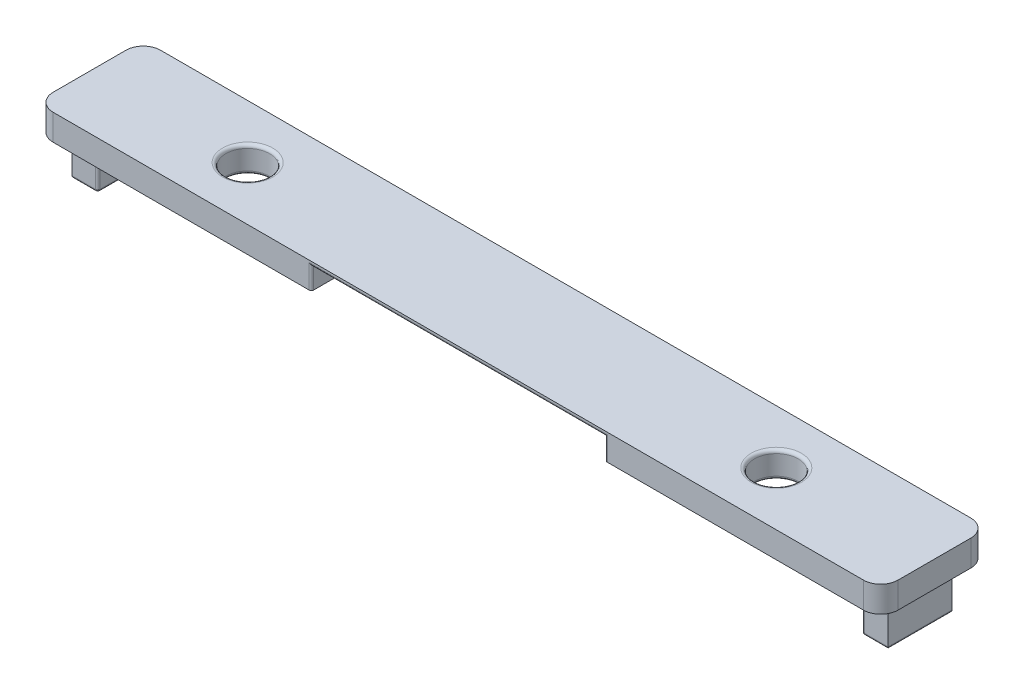
from build123d import *
from OCP.BRepFilletAPI import BRepFilletAPI_MakeFillet

# Parameters (mm, degrees)
SKETCH1_W             = 195
SKETCH1_H             = 24.8
SKETCH1_R             = 5.05
BOSS_EXTRUDE1_DEPTH   = 6
CUT_EXTRUDE1_DEPTH    = 33.9
FILLET1_R1            = 0.75
FILLET1_R2            = 4
FILLET1_R3            = 0.5
BOSS_EXTRUDE2_DEPTH   = 10
FILLET2_R1            = 3
FILLET2_R2            = 0.5
FILLET2_OF_MIRROR1_R1 = 3
FILLET2_OF_MIRROR1_R2 = 0.5


with BuildPart() as part:
    # Sketch1 → Boss-Extrude1 (new body)
    with BuildSketch(Plane(origin=(0, 0, 0), x_dir=(1, 0, 0), z_dir=(0, 1, 0))):
        Rectangle(SKETCH1_W, SKETCH1_H)
        with Locations(Location((-61, 0, 0), (0, 0, 270))):
            Circle(SKETCH1_R, mode=Mode.SUBTRACT)
        with Locations(Location((61, 0, 0), (0, 0, 270))):
            Circle(SKETCH1_R, mode=Mode.SUBTRACT)
    extrude(amount=BOSS_EXTRUDE1_DEPTH)

    # Sketch2 → Cut-Extrude1 (cut, symmetric)
    with BuildSketch(Plane(origin=(0, 0, 0), x_dir=(0, 0, -1), z_dir=(1, 0, 0))):
        with BuildLine():
            Line((-12.4, 0), (-12.4, 5))
            add(Edge.make_bspline(
                [(7.5, 0), (7.5, 5), (-12.4, 5)],
                knots=[3.141592654, 3.141592654, 3.141592654, 4.71238898, 4.71238898, 4.71238898], degree=2, weights=[1, 0.707106781, 1]))
            Line((7.5, 0), (-12.4, 0))
        make_face()
    extrude(amount=CUT_EXTRUDE1_DEPTH, both=True, mode=Mode.SUBTRACT)

    # Fillet1: one fillet with a radius per group of edges: ONE call of the kernel's fillet builder (fillet() takes one radius for all edges)
    fillet1_edges_1 = [part.edges().sort_by_distance(p)[0] for p in [
        (-61, 0, -5.05),
        (-61, 6, -5.05),
        (61, 0, -5.05),
        (61, 6, -5.05),
    ]]
    fillet1_edges_2 = [part.edges().sort_by_distance(p)[0] for p in [
        (97.5, 3, 12.4),
        (-97.5, 3, 12.4),
        (-97.5, 3, -12.4),
        (97.5, 3, -12.4),
    ]]
    fillet1_edges_3 = [part.edges().sort_by_distance(p)[0] for p in [
        (-33.9, 2.5, 12.4),
        (16.95, 5, 12.4),
        (33.9, 2.5, 12.4),
    ]]
    fillet1 = BRepFilletAPI_MakeFillet(part.part.solid().wrapped)
    for e in fillet1_edges_1:
        fillet1.Add(FILLET1_R1, e.wrapped)
    for e in fillet1_edges_2:
        fillet1.Add(FILLET1_R2, e.wrapped)
    for e in fillet1_edges_3:
        fillet1.Add(FILLET1_R3, e.wrapped)
    add(Compound.cast(fillet1.Shape()), mode=Mode.REPLACE)

    # Sketch3 → Boss-Extrude2 (add)
    with BuildSketch(Plane.XZ):
        with BuildLine():
            Line((88.7, -7.4), (94.2, -7.4))
            Line((94.2, -7.4), (94.2, 7.4))
            Line((94.2, 7.4), (88.7, 7.4))
            ThreePointArc((88.7, 7.4), (88.346446609, 7.253553391), (88.2, 6.9))
            Line((88.2, 6.9), (88.2, -6.9))
            ThreePointArc((88.2, -6.9), (88.346446609, -7.253553391), (88.7, -7.4))
        make_face()
    boss_extrude2 = extrude(amount=BOSS_EXTRUDE2_DEPTH)

    # Fillet2: one fillet with a radius per group of edges: ONE call of the kernel's fillet builder (fillet() takes one radius for all edges)
    fillet2_edges_1 = [part.edges().sort_by_distance(p)[0] for p in [
        (94.2, 0, 0),
    ]]
    fillet2_edges_2 = [part.edges().sort_by_distance(p)[0] for p in [
        (91.45, -10, -7.4),
        (94.2, -10, 0),
    ]]
    fillet2 = BRepFilletAPI_MakeFillet(part.part.solid().wrapped)
    for e in fillet2_edges_1:
        fillet2.Add(FILLET2_R1, e.wrapped)
    for e in fillet2_edges_2:
        fillet2.Add(FILLET2_R2, e.wrapped)
    add(Compound.cast(fillet2.Shape()), mode=Mode.REPLACE)

    # Mirror1: Boss-Extrude2 across plane
    add(boss_extrude2.mirror(Plane(origin=(0, 0, 0), x_dir=(0, 0, 1), z_dir=(1, 0, 0))))

    # Fillet2 of Mirror1: one fillet with a radius per group of edges: ONE call of the kernel's fillet builder (fillet() takes one radius for all edges)
    fillet2_of_mirror1_edges_1 = [part.edges().sort_by_distance(p)[0] for p in [
        (-94.2, 0, 0),
    ]]
    fillet2_of_mirror1_edges_2 = [part.edges().sort_by_distance(p)[0] for p in [
        (-91.45, -10, -7.4),
        (-94.2, -10, 0),
    ]]
    fillet2_of_mirror1 = BRepFilletAPI_MakeFillet(part.part.solid().wrapped)
    for e in fillet2_of_mirror1_edges_1:
        fillet2_of_mirror1.Add(FILLET2_OF_MIRROR1_R1, e.wrapped)
    for e in fillet2_of_mirror1_edges_2:
        fillet2_of_mirror1.Add(FILLET2_OF_MIRROR1_R2, e.wrapped)
    add(Compound.cast(fillet2_of_mirror1.Shape()), mode=Mode.REPLACE)


solid = part.part
